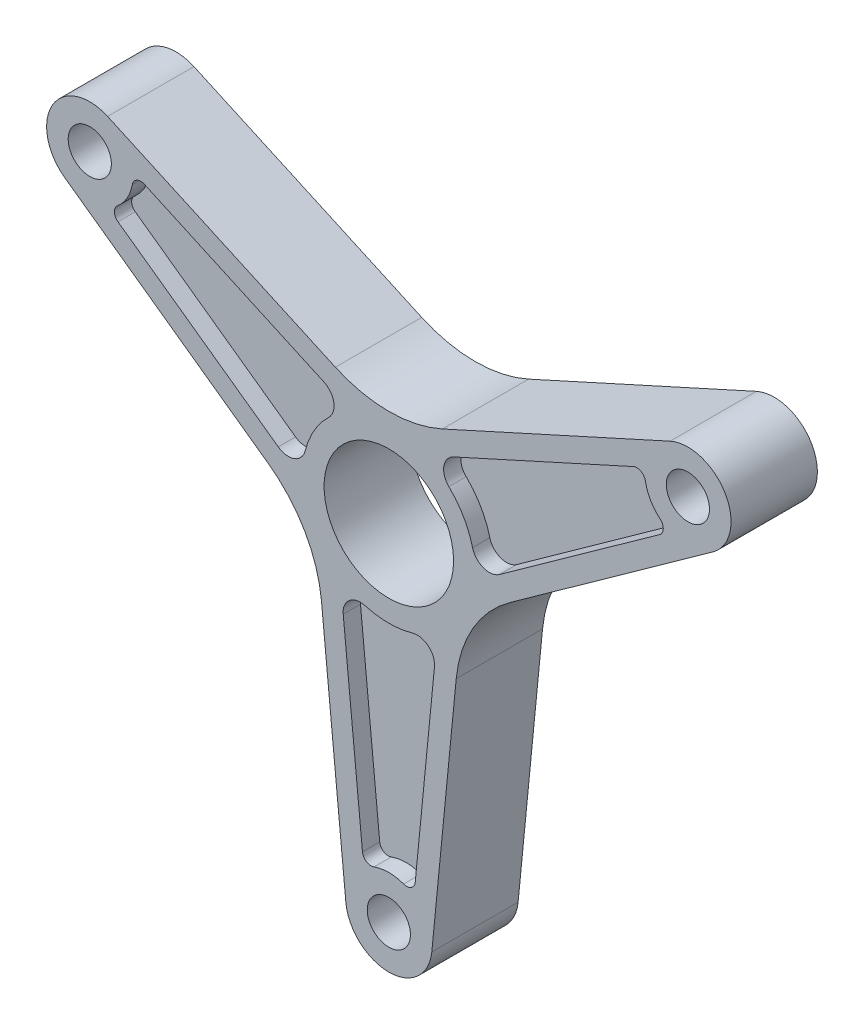
from build123d import *

# Parameters (mm, degrees)
SKETCH2_R           = 15
SKETCH2_R_2         = 5
BOSS_EXTRUDE1_DEPTH = 20
CUT_EXTRUDE1_START  = -4
CUT_EXTRUDE1_DEPTH  = 4
CUT_EXTRUDE2_DEPTH  = 4


with BuildPart() as part:
    # Sketch2 → Boss-Extrude1 (new body)
    with BuildSketch(Plane.XY):
        with BuildLine():
            Line((-9.952202212, -80.976560871), (-15.609727063, -23.320317388))
            ThreePointArc((-15.609727063, -23.320317388), (-19.485571585, -11.25), (-28.000850814, -1.858261489))
            Line((-28.000850814, -1.858261489), (-75.103859931, 31.869420496))
            ThreePointArc((-75.103859931, 31.869420496), (-77.942286341, 45), (-65.151657719, 49.107140374))
            Line((-65.151657719, 49.107140374), (-12.391123751, 25.178578877))
            ThreePointArc((-12.391123751, 25.178578877), (0, 22.5), (12.391123751, 25.178578877))
            Line((12.391123751, 25.178578877), (65.151657719, 49.107140374))
            ThreePointArc((65.151657719, 49.107140374), (77.942286341, 45), (75.103859931, 31.869420496))
            Line((75.103859931, 31.869420496), (28.000850814, -1.858261489))
            ThreePointArc((28.000850814, -1.858261489), (19.485571585, -11.25), (15.609727063, -23.320317388))
            Line((15.609727063, -23.320317388), (9.952202212, -80.976560871))
            ThreePointArc((9.952202212, -80.976560871), (0, -90), (-9.952202212, -80.976560871))
        make_face()
        Circle(SKETCH2_R, mode=Mode.SUBTRACT)
        with Locations((0, -80)):
            Circle(SKETCH2_R_2, mode=Mode.SUBTRACT)
        with Locations((-69.282032303, 40)):
            Circle(SKETCH2_R_2, mode=Mode.SUBTRACT)
        with Locations((69.282032303, 40)):
            Circle(SKETCH2_R_2, mode=Mode.SUBTRACT)
    extrude(amount=BOSS_EXTRUDE1_DEPTH)

    # Sketch3 → Cut-Extrude1 (cut)
    with BuildSketch(Plane.XY.offset(20).offset(CUT_EXTRUDE1_START)):
        with BuildLine():
            Line((-10.571217344, -23.468047631), (-6.110762303, -68.924866408))
            ThreePointArc((-6.110762303, -68.924866408), (-5.184804891, -70.422739362), (-3.43360155, -70.607961862))
            ThreePointArc((-3.43360155, -70.607961862), (0, -70), (3.43360155, -70.607961862))
            ThreePointArc((3.43360155, -70.607961862), (5.184804891, -70.422739362), (6.110762303, -68.924866408))
            Line((6.110762303, -68.924866408), (10.571217344, -23.468047631))
            ThreePointArc((10.571217344, -23.468047631), (9.152550004, -20.00576872), (5.491947049, -19.231186069))
            ThreePointArc((5.491947049, -19.231186069), (0, -20), (-5.491947049, -19.231186069))
            ThreePointArc((-5.491947049, -19.231186069), (-9.152550004, -20.00576872), (-10.571217344, -23.468047631))
        make_face()
        with BuildLine():
            Line((-25.609534097, 2.579081047), (-62.746066413, 29.170357813))
            ThreePointArc((-62.746066413, 29.170357813), (-63.580283737, 30.721196932), (-62.865089457, 32.330394762))
            ThreePointArc((-62.865089457, 32.330394762), (-60.621778265, 35), (-59.431487906, 38.2775671))
            ThreePointArc((-59.431487906, 38.2775671), (-58.395478846, 39.70154243), (-56.63530411, 39.754508595))
            Line((-56.63530411, 39.754508595), (-15.038316754, 20.888966584))
            ThreePointArc((-15.038316754, 20.888966584), (-12.749228932, 17.929225173), (-13.908722156, 14.371758695))
            ThreePointArc((-13.908722156, 14.371758695), (-17.320508076, 10), (-19.400669205, 4.859427374))
            ThreePointArc((-19.400669205, 4.859427374), (-21.901778936, 2.076543547), (-25.609534097, 2.579081047))
        make_face()
        with BuildLine():
            Line((15.038316754, 20.888966584), (56.63530411, 39.754508595))
            ThreePointArc((56.63530411, 39.754508595), (58.395478846, 39.70154243), (59.431487906, 38.2775671))
            ThreePointArc((59.431487906, 38.2775671), (60.621778265, 35), (62.865089457, 32.330394762))
            ThreePointArc((62.865089457, 32.330394762), (63.580283737, 30.721196932), (62.746066413, 29.170357813))
            Line((62.746066413, 29.170357813), (25.609534097, 2.579081047))
            ThreePointArc((25.609534097, 2.579081047), (21.901778936, 2.076543547), (19.400669205, 4.859427374))
            ThreePointArc((19.400669205, 4.859427374), (17.320508076, 10), (13.908722156, 14.371758695))
            ThreePointArc((13.908722156, 14.371758695), (12.749228932, 17.929225173), (15.038316754, 20.888966584))
        make_face()
    extrude(amount=CUT_EXTRUDE1_DEPTH, mode=Mode.SUBTRACT)

    # Sketch4 → Cut-Extrude2 (cut)
    with BuildSketch(Plane(origin=(0, 0, 0), x_dir=(-1, 0, 0), z_dir=(0, 0, -1))):
        with BuildLine():
            Line((-10.571217344, -23.468047631), (-6.110762303, -68.924866408))
            ThreePointArc((-6.110762303, -68.924866408), (-5.184804891, -70.422739362), (-3.43360155, -70.607961862))
            ThreePointArc((-3.43360155, -70.607961862), (0, -70), (3.43360155, -70.607961862))
            ThreePointArc((3.43360155, -70.607961862), (5.184804891, -70.422739362), (6.110762303, -68.924866408))
            Line((6.110762303, -68.924866408), (10.571217344, -23.468047631))
            ThreePointArc((10.571217344, -23.468047631), (9.152550004, -20.00576872), (5.491947049, -19.231186069))
            ThreePointArc((5.491947049, -19.231186069), (0, -20), (-5.491947049, -19.231186069))
            ThreePointArc((-5.491947049, -19.231186069), (-9.152550004, -20.00576872), (-10.571217344, -23.468047631))
        make_face()
        with BuildLine():
            Line((-25.609534097, 2.579081047), (-62.746066413, 29.170357813))
            ThreePointArc((-62.746066413, 29.170357813), (-63.580283737, 30.721196932), (-62.865089457, 32.330394762))
            ThreePointArc((-62.865089457, 32.330394762), (-60.621778265, 35), (-59.431487906, 38.2775671))
            ThreePointArc((-59.431487906, 38.2775671), (-58.395478846, 39.70154243), (-56.63530411, 39.754508595))
            Line((-56.63530411, 39.754508595), (-15.038316754, 20.888966584))
            ThreePointArc((-15.038316754, 20.888966584), (-12.749228932, 17.929225173), (-13.908722156, 14.371758695))
            ThreePointArc((-13.908722156, 14.371758695), (-17.320508076, 10), (-19.400669205, 4.859427374))
            ThreePointArc((-19.400669205, 4.859427374), (-21.901778936, 2.076543547), (-25.609534097, 2.579081047))
        make_face()
        with BuildLine():
            Line((15.038316754, 20.888966584), (56.63530411, 39.754508595))
            ThreePointArc((56.63530411, 39.754508595), (58.395478846, 39.70154243), (59.431487906, 38.2775671))
            ThreePointArc((59.431487906, 38.2775671), (60.621778265, 35), (62.865089457, 32.330394762))
            ThreePointArc((62.865089457, 32.330394762), (63.580283737, 30.721196932), (62.746066413, 29.170357813))
            Line((62.746066413, 29.170357813), (25.609534097, 2.579081047))
            ThreePointArc((25.609534097, 2.579081047), (21.901778936, 2.076543547), (19.400669205, 4.859427374))
            ThreePointArc((19.400669205, 4.859427374), (17.320508076, 10), (13.908722156, 14.371758695))
            ThreePointArc((13.908722156, 14.371758695), (12.749228932, 17.929225173), (15.038316754, 20.888966584))
        make_face()
    extrude(amount=-CUT_EXTRUDE2_DEPTH, mode=Mode.SUBTRACT)


solid = part.part
